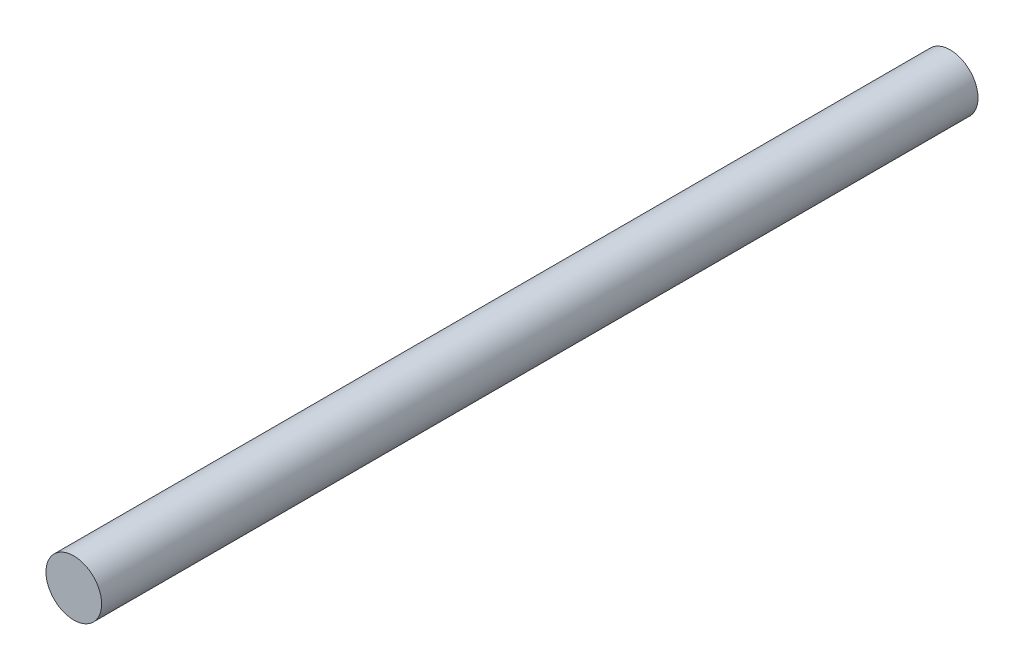
from build123d import *

# Parameters (mm, degrees)
SKETCH1_R         = 4
GUIDE_SHAFT_DEPTH = 126


with BuildPart() as part:
    # Sketch1 → Guide_Shaft (new body)
    with BuildSketch(Plane.XY):
        Circle(SKETCH1_R)
    extrude(amount=GUIDE_SHAFT_DEPTH)


solid = part.part
